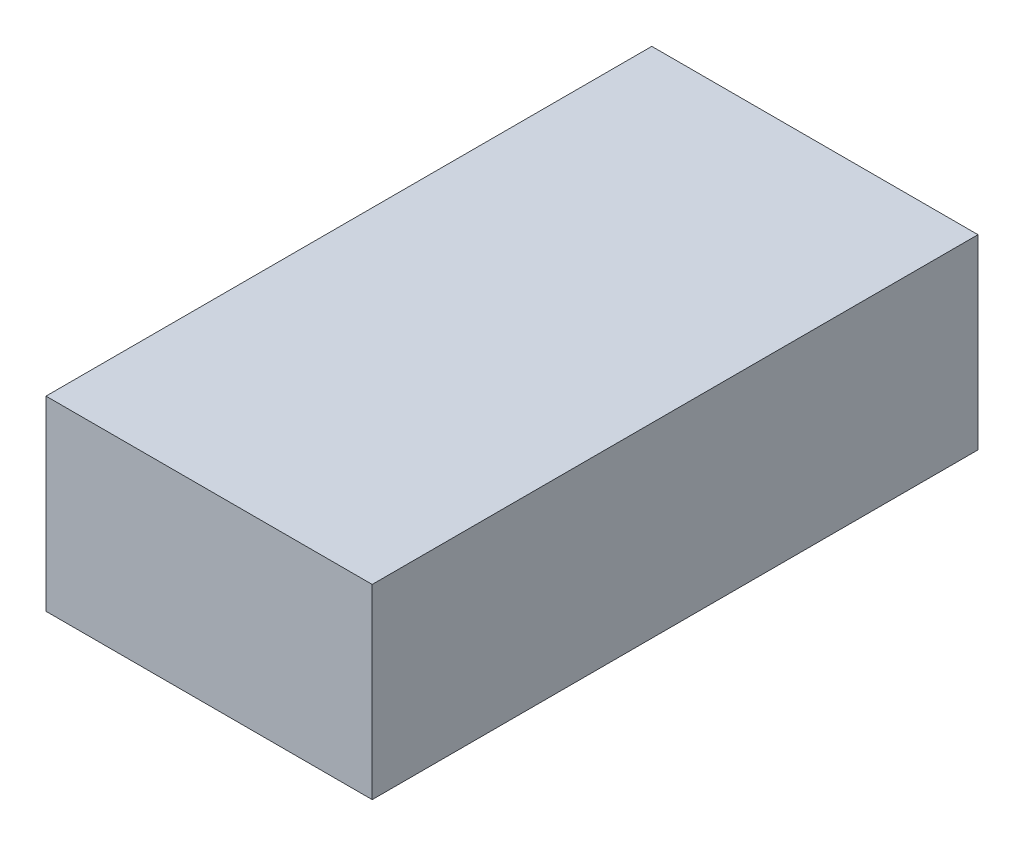
from build123d import *

# Parameters (mm, degrees)
PRESS_UC_PENCE_GOVDE_1_START = -100
SKETCH1_W                    = 140
SKETCH1_H                    = 80
PRESS_UC_PENCE_GOVDE_1_DEPTH = 260


with BuildPart() as part:
    # Sketch1 → PRESS_uc_pence_govde_1 (new body)
    with BuildSketch(Plane.XY.offset(PRESS_UC_PENCE_GOVDE_1_START)):
        with Locations((130, 1214)):
            Rectangle(SKETCH1_W, SKETCH1_H)
    extrude(amount=-PRESS_UC_PENCE_GOVDE_1_DEPTH)


solid = part.part
